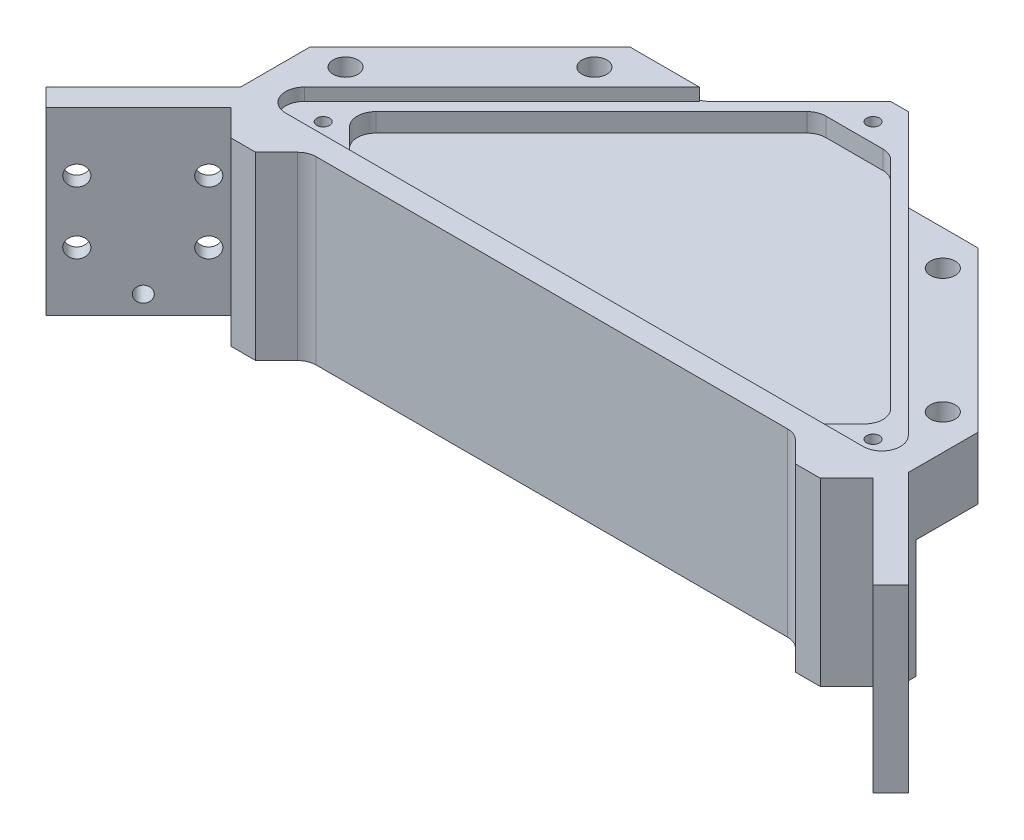
from build123d import *

# Parameters (mm, degrees)
SKETCH_1_R                   = 1
SKETCH_1_R_2                 = 2
EXTRUDE_1_DEPTH              = 29
CUT_EXTRUDE_1_DEPTH          = 5
CUT_EXTRUDE_START            = -10
CUT_EXTRUDE_2_DEPTH          = 19
CUT_EXTRUDE_3_DEPTH          = 2
SKETCH_11_R                  = 1.6
CUT_EXTRUDE_4_DEPTH          = 104.437531222
SKETCH_13_R                  = 1.25
CUT_EXTRUDE_5_DEPTH          = 2
HOLE_WIZARD_M2_5_6_D         = 2.05
HOLE_WIZARD_M3_1_D           = 2.5
HOLE_WIZARD_M3_1_CSINK_D     = 3.05
HOLE_WIZARD_M3_1_CSINK_ANGLE = 90
CHAMFER_1_SIZE               = 2
FILLET_1_R                   = 3
CHAMFER_2_SIZE               = 1.65


with BuildPart() as part:
    # 草图1 → 凸台-拉伸1 (new body)
    with BuildSketch(Plane(origin=(0, 0, 0), x_dir=(1, 0, 0), z_dir=(0, 1, 0))):
        Polygon((-53.656854249, -3.776840134), (-53.656854249, -14.986472232), (-69.296464556, -30.626082539), (-66.468037432, -33.454509664), (-51.618795027, -18.605267259), (-47.376154339, -22.847907946), (-43.376154339, -22.847907946), (-39.133513652, -18.605267259), (39.133513652, -18.605267259), (43.376154339, -22.847907946), (47.376154339, -22.847907946), (51.618795027, -18.605267259), (66.468037432, -33.454509664), (69.296464556, -30.626082539), (53.656854249, -14.986472232), (53.656854249, -3.776840134), (28, 21.880014115), (16.790367902, 21.880014115), (0, 38.670382017), (-16.790367902, 21.880014115), (-28, 21.880014115), align=None)
        with Locations((-44.194173824, -11.180646057)):
            Circle(SKETCH_1_R, mode=Mode.SUBTRACT)
        with Locations((-48, -3.776840134)):
            Circle(SKETCH_1_R_2, mode=Mode.SUBTRACT)
        with Locations((44.194173824, -11.180646057)):
            Circle(SKETCH_1_R, mode=Mode.SUBTRACT)
        with Locations((48, -3.776840134)):
            Circle(SKETCH_1_R_2, mode=Mode.SUBTRACT)
        with Locations((-28, 16.223159866)):
            Circle(SKETCH_1_R_2, mode=Mode.SUBTRACT)
        with Locations((28, 16.223159866)):
            Circle(SKETCH_1_R_2, mode=Mode.SUBTRACT)
        with Locations((0, 33.013527768)):
            Circle(SKETCH_1_R, mode=Mode.SUBTRACT)
    extrude(amount=-EXTRUDE_1_DEPTH)

    # 草图1<3> → 切除-拉伸1 (cut)
    with BuildSketch(Plane(origin=(0, 0, 0), x_dir=(1, 0, 0), z_dir=(0, 1, 0))):
        Polygon((5.828427125, 30.013527768), (-5.828427125, 30.013527768), (-43.487067043, -7.645112151), (-37.355339059, -13.776840134), (37.355339059, -13.776840134), (43.487067043, -7.645112151), align=None)
    extrude(amount=-CUT_EXTRUDE_1_DEPTH, mode=Mode.SUBTRACT)

    # 草图3 → 切除-拉伸2 (cut)
    with BuildSketch(Plane(origin=(0, 0, 0), x_dir=(1, 0, 0), z_dir=(0, 1, 0)).offset(CUT_EXTRUDE_START)):
        Polygon((-74.127206293, -13.776840134), (70.632375227, -13.776840134), (4.598461929, 56.317971506), align=None)
    extrude(amount=-CUT_EXTRUDE_2_DEPTH, mode=Mode.SUBTRACT)

    # 草图4 → 切除-拉伸3 (cut)
    with BuildSketch(Plane(origin=(0, 0, 0), x_dir=(1, 0, 0), z_dir=(0, 1, 0))):
        with BuildLine():
            Line((-2.121320344, 36.549061673), (-48.535533906, -9.865151889))
            ThreePointArc((-48.535533906, -9.865151889), (-49.18585216, -13.13452253), (-46.414213562, -14.986472232))
            Line((-46.414213562, -14.986472232), (46.414213562, -14.986472232))
            ThreePointArc((46.414213562, -14.986472232), (49.18585216, -13.13452253), (48.535533906, -9.865151889))
            Line((48.535533906, -9.865151889), (0, 38.670382017))
            Line((0, 38.670382017), (-2.121320344, 36.549061673))
        make_face()
    extrude(amount=-CUT_EXTRUDE_3_DEPTH, mode=Mode.SUBTRACT)

    # 草图11 → 切除-拉伸4 (cut, through all)
    with BuildSketch(Plane(origin=(-16.506763884, 0, -16.506763884), x_dir=(0.7071067811865477, 0, -0.7071067811865474), z_dir=(0.7071067811865474, 0, 0.7071067811865477))):
        with Locations((-52.155910645, -9.5)):
            Circle(SKETCH_11_R)
        with Locations((-52.155910645, -19.5)):
            Circle(SKETCH_11_R)
        with Locations((-67.155910645, -19.5)):
            Circle(SKETCH_11_R)
        with Locations((-67.155910645, -9.5)):
            Circle(SKETCH_11_R)
    cut_extrude_4 = extrude(amount=-CUT_EXTRUDE_4_DEPTH, mode=Mode.SUBTRACT)

    # 草图13 → 切除-拉伸5 (cut)
    with BuildSketch(Plane(origin=(-19.335191009, 0, -19.335191009), x_dir=(-0.7071067811865488, 0, 0.7071067811865462), z_dir=(-0.7071067811865462, 0, -0.7071067811865488))):
        with Locations((59.597036142, -26)):
            Circle(SKETCH_13_R)
    cut_extrude_5 = extrude(amount=-CUT_EXTRUDE_5_DEPTH, mode=Mode.SUBTRACT)

    # M2.5 螺纹孔6 (through all)
    with Locations(Plane(origin=(0, -2, -33.013527768), x_dir=(0, 0, 1), z_dir=(0, 1, 0))):
        with Locations((0, 0), (44.194173825, -44.194173824), (44.194173825, 44.194173824)):
            Hole(HOLE_WIZARD_M2_5_6_D / 2)

    # M3 螺纹孔1 (through all)
    with Locations(Plane(origin=(-61.476659403, -26, 22.806277386), x_dir=(-0.707106781187, 0, 0.707106781187), z_dir=(-0.707106781187, 0, -0.707106781187))):
        with Locations((0, 0)):
            hole_wizard_m3_1 = CounterSinkHole(HOLE_WIZARD_M3_1_D / 2, HOLE_WIZARD_M3_1_CSINK_D / 2, counter_sink_angle=HOLE_WIZARD_M3_1_CSINK_ANGLE)

    # 镜向2: 切除-拉伸4, 切除-拉伸5, M3 螺纹孔1 across plane
    add(cut_extrude_4.mirror(Plane.ZY), mode=Mode.SUBTRACT)
    add(cut_extrude_5.mirror(Plane.ZY), mode=Mode.SUBTRACT)
    add(hole_wizard_m3_1.mirror(Plane.ZY), mode=Mode.SUBTRACT)

    # 倒角1
    chamfer_1_edges = [part.edges().sort_by_distance(p)[0] for p in [
        (0, -6, -38.670382017),
    ]]
    chamfer(chamfer_1_edges, length=CHAMFER_1_SIZE)

    # 圆角1
    fillet_1_edges = [part.edges().sort_by_distance(p)[0] for p in [
        (43.487067043, -3.5, 7.645112151),
        (37.355339059, -3.5, 13.776840134),
        (-37.355339059, -3.5, 13.776840134),
        (-43.487067043, -3.5, 7.645112151),
        (5.828427125, -3.5, -30.013527768),
        (-5.828427125, -3.5, -30.013527768),
        (-39.133513652, -14.5, 18.605267259),
        (39.133513652, -14.5, 18.605267259),
        (16.790367902, -6, -21.880014115),
        (-16.790367902, -6, -21.880014115),
    ]]
    fillet(fillet_1_edges, radius=FILLET_1_R)

    # 倒角2
    chamfer_2_edges = [part.edges().sort_by_distance(p)[0] for p in [
        (-67.952961672, -9.5, 29.282579655),
        (-67.952961672, -19.5, 29.282579655),
        (-57.346359954, -19.5, 18.675977937),
        (-57.346359954, -9.5, 18.675977937),
        (57.346359954, -19.5, 18.675977937),
        (67.952961672, -19.5, 29.282579655),
        (67.952961672, -9.5, 29.282579655),
        (57.346359954, -9.5, 18.675977937),
    ]]
    chamfer(chamfer_2_edges, length=CHAMFER_2_SIZE)


solid = part.part
